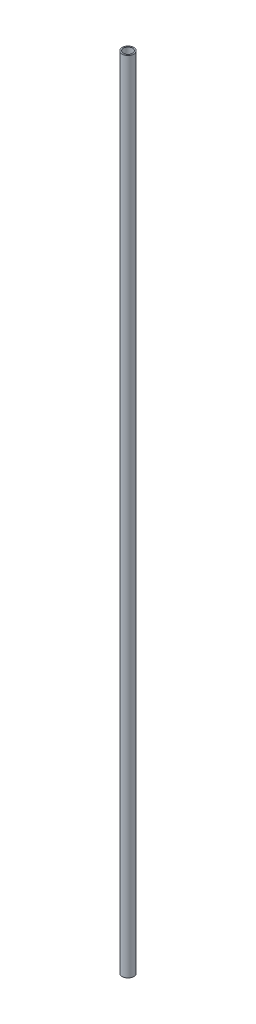
from build123d import *

# Parameters (mm, degrees)
SKETCH1_R           = 5.1
SKETCH1_R_2         = 4
BOSS_EXTRUDE1_DEPTH = 703


with BuildPart() as part:
    # Sketch1 → Boss-Extrude1 (new body)
    with BuildSketch(Plane(origin=(0, 0, 0), x_dir=(1, 0, 0), z_dir=(0, 1, 0))):
        with Locations(Location((0, 0, 0), (0, 0, 270))):
            Circle(SKETCH1_R)
        with Locations(Location((0, 0, 0), (0, 0, 270))):
            Circle(SKETCH1_R_2, mode=Mode.SUBTRACT)
    extrude(amount=BOSS_EXTRUDE1_DEPTH)


solid = part.part
